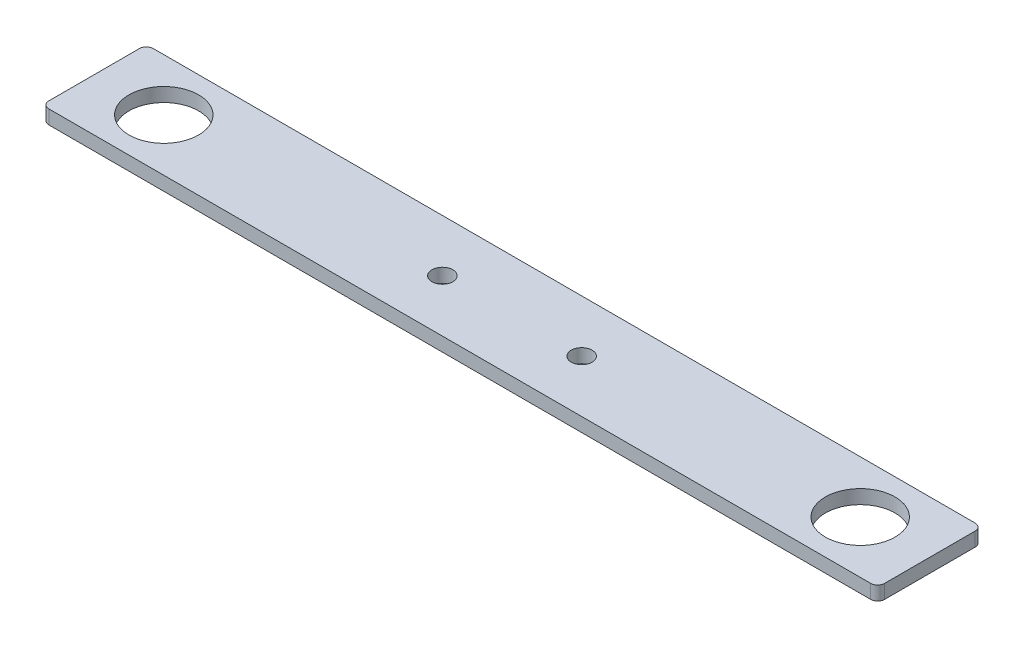
from build123d import *

# Parameters (mm, degrees)
SKETCH1_W           = 120
SKETCH1_H           = 15
SKETCH1_R           = 5
SKETCH1_R_2         = 1.5
BOSS_EXTRUDE1_DEPTH = 2
FILLET1_R           = 1


with BuildPart() as part:
    # Sketch1 → Boss-Extrude1 (new body)
    with BuildSketch(Plane(origin=(0, 0, 0), x_dir=(1, 0, 0), z_dir=(0, 1, 0))):
        with Locations((60, 7.5)):
            Rectangle(SKETCH1_W, SKETCH1_H)
        with Locations(Location((10, 7.5, 0), (0, 0, 270))):
            Circle(SKETCH1_R, mode=Mode.SUBTRACT)
        with Locations(Location((110, 7.5, 0), (0, 0, 270))):
            Circle(SKETCH1_R, mode=Mode.SUBTRACT)
        with Locations(Location((50, 7.5, 0), (0, 0, 270))):
            Circle(SKETCH1_R_2, mode=Mode.SUBTRACT)
        with Locations(Location((70, 7.5, 0), (0, 0, 270))):
            Circle(SKETCH1_R_2, mode=Mode.SUBTRACT)
    extrude(amount=BOSS_EXTRUDE1_DEPTH)

    # Fillet1
    fillet1_edges = [part.edges().sort_by_distance(p)[0] for p in [
        (120, 1, 0),
        (0, 1, 0),
        (0, 1, -15),
        (120, 1, -15),
    ]]
    fillet(fillet1_edges, radius=FILLET1_R)


solid = part.part
